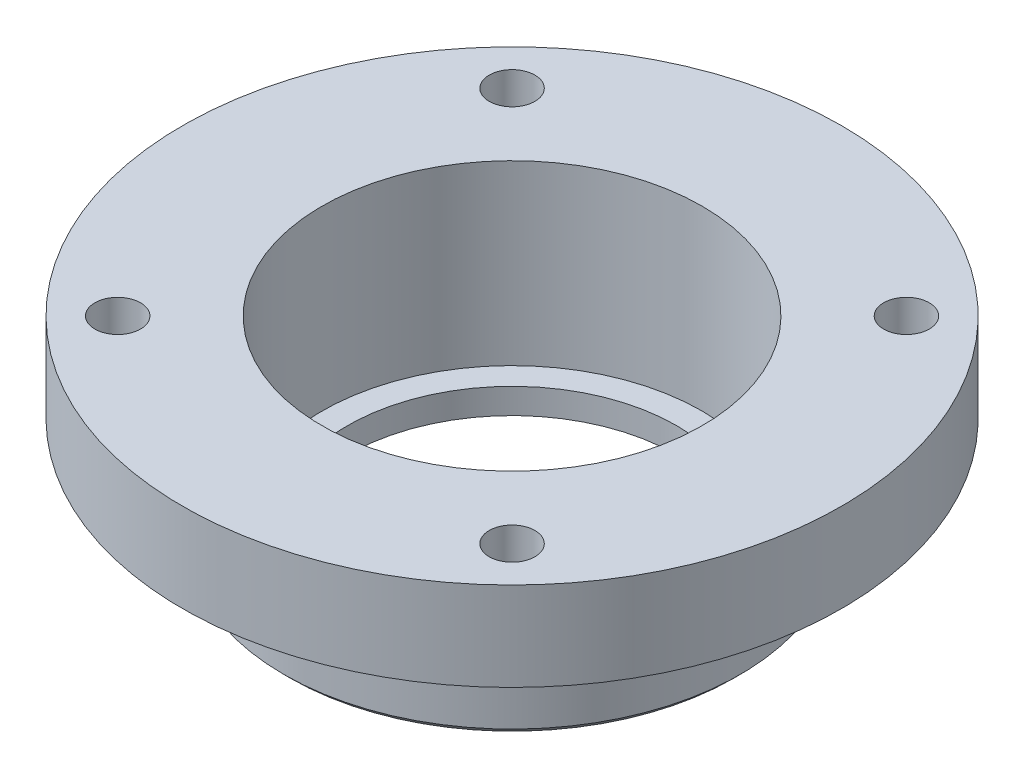
from build123d import *

# Parameters (mm, degrees)
CHAMFER_1_SIZE           = 0.5
HOLE_WIZARD_M31_D        = 3.6
PATTERN_CIRCULAR_1_COUNT = 4


with BuildPart() as part:
    # Эскиз1 → Повернуть1 (revolve)
    with BuildSketch(Plane.XY, mode=Mode.PRIVATE) as revolve_1_sk:
        Polygon((-15, 2), (-15, 16), (-26, 16), (-26, 9), (-18, 9), (-18, 0), (-13, 0), (-13, 2), align=None)
    revolve(revolve_1_sk.sketch.rotate(Axis((0, 0, 0), (0, 1, 0)), 270), axis=Axis((0, 0, 0), (0, 1, 0)))

    # Фаска1
    chamfer_1_edges = [part.edges().sort_by_distance(p)[0] for p in [
        (0, 0, 18),
    ]]
    chamfer(chamfer_1_edges, length=CHAMFER_1_SIZE)

    # Отверстие с зазором M31 (through all)
    with Locations(Plane(origin=(0, 16, 0), x_dir=(1, 0, 0), z_dir=(0, 1, 0))):
        with Locations((15.556349186, -15.556349186)):
            hole_wizard_m31 = Hole(HOLE_WIZARD_M31_D / 2)

    # Круговой массив1: Отверстие с зазором M31 ×4 about axis
    pattern_circular_1_axis = Axis((0, 0, 0), (0, 1, 0))
    for i in range(1, PATTERN_CIRCULAR_1_COUNT):
        add(hole_wizard_m31.rotate(pattern_circular_1_axis, i * 360 / PATTERN_CIRCULAR_1_COUNT), mode=Mode.SUBTRACT)


solid = part.part
